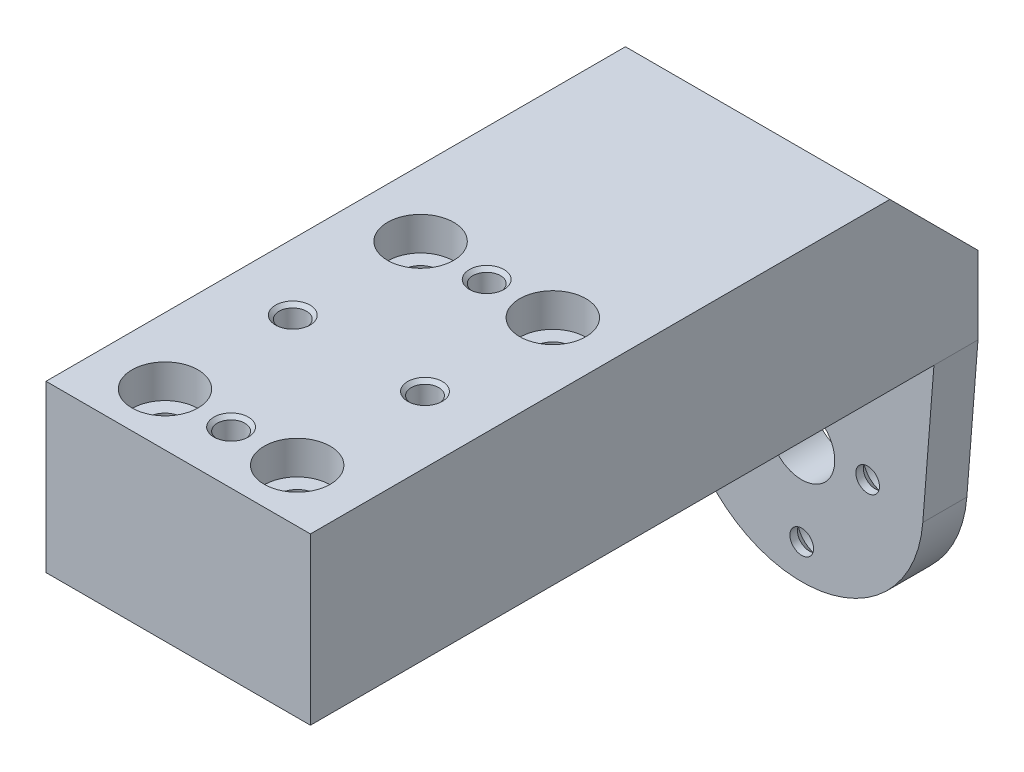
from build123d import *

# Parameters (mm, degrees)
SKETCH1_W                                       = 38.1
SKETCH1_H                                       = 23.876
GEARBOX_MOUNT_DEPTH                             = 48.26
CBORE_FOR_4_SOCKET_HEAD_CAP_SCREW1_D            = 3.2639
CBORE_FOR_4_SOCKET_HEAD_CAP_SCREW1_DEPTH        = 12.7
CBORE_FOR_4_SOCKET_HEAD_CAP_SCREW1_CBORE_D      = 3.96875
CBORE_FOR_4_SOCKET_HEAD_CAP_SCREW1_CBORE_DEPTH  = 4.7625
CBORE_FOR_4_SOCKET_HEAD_CAP_SCREW1_TIP          = 0.980574487
INSERT_INSTALLATION_CHAMFERS_SIZE               = 0.508
SKETCH7_W                                       = 38.1
SKETCH7_H                                       = 23.876
MOTOR_MOUNT_EXTENSION_DEPTH                     = 41.5798
CBORE_FOR_10_SOCKET_HEAD_CAP_SCREW1_D           = 5.1054
CBORE_FOR_10_SOCKET_HEAD_CAP_SCREW1_CBORE_D     = 9.525
CBORE_FOR_10_SOCKET_HEAD_CAP_SCREW1_CBORE_DEPTH = 4.826
MOTOR_MOUNT_PLATE_DEPTH                         = 6.35
SHAFT_CLEARANCE_REACH                           = 111.391
SKETCH9_R                                       = 4.7625
CSK_FOR_M3_FLAT_HEAD_MACHINE_SCREW1_AT_2_COUNT  = 2
CSK_FOR_M3_FLAT_HEAD_MACHINE_SCREW1_AT_2_PITCH  = 19
CSK_FOR_M3_FLAT_HEAD_MACHINE_SCREW1_AT_3_COUNT  = 2
CSK_FOR_M3_FLAT_HEAD_MACHINE_SCREW1_AT_3_PITCH  = 15.700318468
CSK_FOR_M3_FLAT_HEAD_MACHINE_SCREW1_AT_4_COUNT  = 2
CSK_FOR_M3_FLAT_HEAD_MACHINE_SCREW1_AT_4_PITCH  = 15.700318468
CHAMFER2_SIZE                                   = 12.7


with BuildPart() as part:
    # Sketch1 → Gearbox Mount (new body)
    with BuildSketch(Plane.XY):
        Rectangle(SKETCH1_W, SKETCH1_H)
    extrude(amount=GEARBOX_MOUNT_DEPTH)

    # CBORE for #4 Socket Head Cap Screw1
    with Locations(Plane(origin=(0, 11.938, 0), x_dir=(1, 0, 0), z_dir=(0, 1, 0))):
        with Locations((0, -3.81), (-9.525, -22.225), (0, -40.64), (9.525, -22.225)):
            CounterBoreHole(CBORE_FOR_4_SOCKET_HEAD_CAP_SCREW1_D / 2, CBORE_FOR_4_SOCKET_HEAD_CAP_SCREW1_CBORE_D / 2, CBORE_FOR_4_SOCKET_HEAD_CAP_SCREW1_CBORE_DEPTH, depth=CBORE_FOR_4_SOCKET_HEAD_CAP_SCREW1_DEPTH)
            with Locations((0, 0, -(CBORE_FOR_4_SOCKET_HEAD_CAP_SCREW1_DEPTH + CBORE_FOR_4_SOCKET_HEAD_CAP_SCREW1_TIP / 2))):  # 118° drill point
                Cone(0, CBORE_FOR_4_SOCKET_HEAD_CAP_SCREW1_D / 2, CBORE_FOR_4_SOCKET_HEAD_CAP_SCREW1_TIP, mode=Mode.SUBTRACT)

    # Insert Installation Chamfers
    insert_installation_chamfers_edges = [part.edges().sort_by_distance(p)[0] for p in [
        (7.540625, 11.938, 22.225),
        (-1.984375, 11.938, 40.64),
        (-11.509375, 11.938, 22.225),
        (-1.984375, 11.938, 3.81),
    ]]
    chamfer(insert_installation_chamfers_edges, length=INSERT_INSTALLATION_CHAMFERS_SIZE)

    # Sketch7 → Motor Mount Extension (add)
    with BuildSketch(Plane(origin=(0, 0, 0), x_dir=(-1, 0, 0), z_dir=(0, 0, -1))):
        Rectangle(SKETCH7_W, SKETCH7_H)
    extrude(amount=MOTOR_MOUNT_EXTENSION_DEPTH)

    # CBORE for #10 Socket Head Cap Screw1 (through all)
    with Locations(Plane(origin=(0, 11.938, 0), x_dir=(1, 0, 0), z_dir=(0, 1, 0))):
        with Locations((-9.525, -40.64), (9.525, -40.64), (9.525, -3.81), (-9.525, -3.81)):
            CounterBoreHole(CBORE_FOR_10_SOCKET_HEAD_CAP_SCREW1_D / 2, CBORE_FOR_10_SOCKET_HEAD_CAP_SCREW1_CBORE_D / 2, CBORE_FOR_10_SOCKET_HEAD_CAP_SCREW1_CBORE_DEPTH)

    # Sketch8 → Motor Mount Plate (add)
    with BuildSketch(Plane(origin=(0, 0, -41.5798), x_dir=(-1, 0, 0), z_dir=(0, 0, -1))):
        with BuildLine():
            Line((19.05, 11.938), (-19.05, 11.938))
            Line((-19.05, 11.938), (-19.05, -11.938))
            Line((-19.05, -11.938), (-17.446279027, -32.358163541))
            ThreePointArc((-17.446279027, -32.358163541), (0, -48.488), (17.446279027, -32.358163541))
            Line((17.446279027, -32.358163541), (19.05, -11.938))
            Line((19.05, -11.938), (19.05, 11.938))
        make_face()
    extrude(amount=MOTOR_MOUNT_PLATE_DEPTH)

    # Sketch9 → Shaft Clearance (cut, up to next)
    with BuildSketch(Plane(origin=(0, 0, -47.9298), x_dir=(-1, 0, 0), z_dir=(0, 0, -1)), mode=Mode.PRIVATE) as shaft_clearance_sk1:
        with Locations((0, -30.988)):
            Circle(SKETCH9_R)
    shaft_clearance_tool1 = extrude(shaft_clearance_sk1.sketch, amount=-SHAFT_CLEARANCE_REACH, mode=Mode.PRIVATE) & part.part
    add(shaft_clearance_tool1.solids().sort_by_distance((0, -30.988, -47.9298))[0], mode=Mode.SUBTRACT)

    # Sketch10 → CSK for M3 Flat Head Machine Screw1 (revolve, cut)
    with BuildSketch(Plane(origin=(9.5, -30.988, -47.9298), x_dir=(0, 1, 0), z_dir=(1, 0, 0))):
        Polygon((0, 0), (0, 6.35), (1.7, 6.35), (1.7, 5.26), (3.15, 3.81), (3.15, 0), align=None)
    csk_for_m3_flat_head_machine_screw1 = revolve(axis=Axis((9.5, -30.988, -54.2798), (0, 0, 1)), mode=Mode.SUBTRACT)

    # CSK for M3 Flat Head Machine Screw1 at 2: CSK for M3 Flat Head Machine Screw1 ×2
    with Locations(*[(-i * CSK_FOR_M3_FLAT_HEAD_MACHINE_SCREW1_AT_2_PITCH, 0, 0) for i in range(1, CSK_FOR_M3_FLAT_HEAD_MACHINE_SCREW1_AT_2_COUNT)]):
        add(csk_for_m3_flat_head_machine_screw1, mode=Mode.SUBTRACT)

    # CSK for M3 Flat Head Machine Screw1 at 3: CSK for M3 Flat Head Machine Screw1 ×2
    with Locations(*[Vector(-0.6050832675335578, 0.7961621941231026, 0) * (i * CSK_FOR_M3_FLAT_HEAD_MACHINE_SCREW1_AT_3_PITCH) for i in range(1, CSK_FOR_M3_FLAT_HEAD_MACHINE_SCREW1_AT_3_COUNT)]):
        add(csk_for_m3_flat_head_machine_screw1, mode=Mode.SUBTRACT)

    # CSK for M3 Flat Head Machine Screw1 at 4: CSK for M3 Flat Head Machine Screw1 ×2
    with Locations(*[Vector(-0.605083267533558, -0.7961621941231024, 0) * (i * CSK_FOR_M3_FLAT_HEAD_MACHINE_SCREW1_AT_4_PITCH) for i in range(1, CSK_FOR_M3_FLAT_HEAD_MACHINE_SCREW1_AT_4_COUNT)]):
        add(csk_for_m3_flat_head_machine_screw1, mode=Mode.SUBTRACT)

    # Chamfer2
    chamfer2_edges = [part.edges().sort_by_distance(p)[0] for p in [
        (0, 11.938, -47.9298),
    ]]
    chamfer(chamfer2_edges, length=CHAMFER2_SIZE)


solid = part.part
